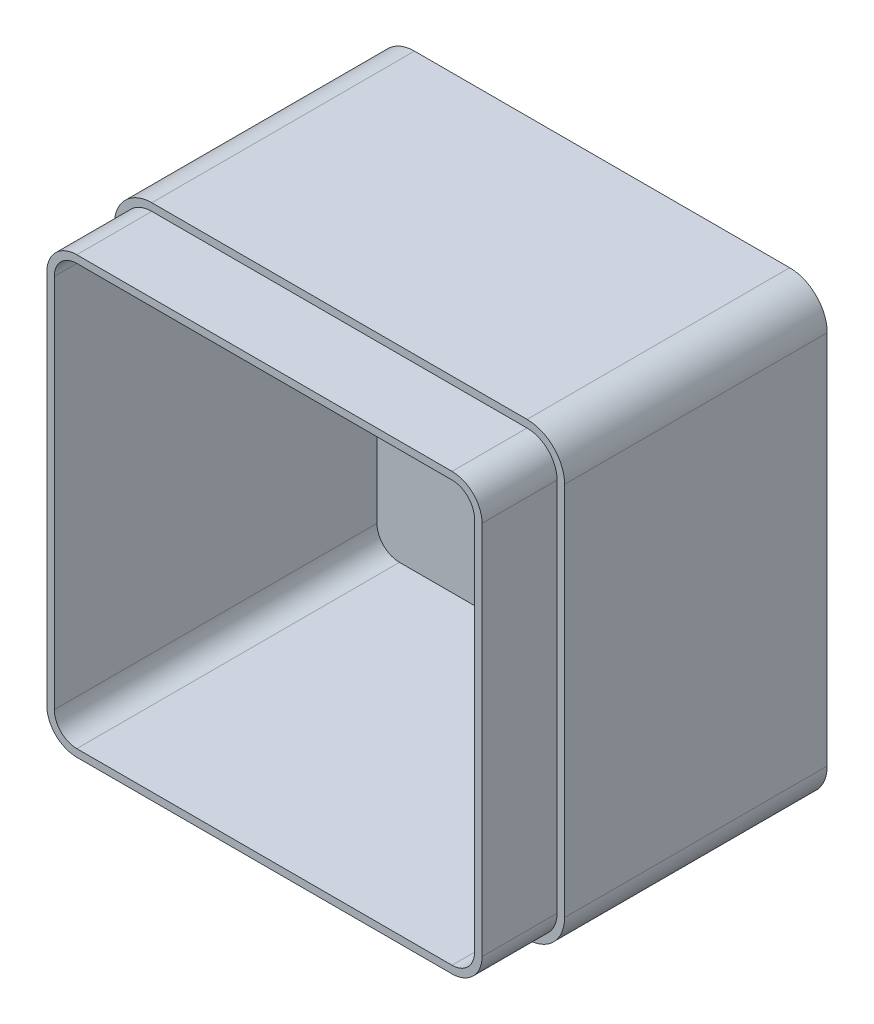
from build123d import *

# Parameters (mm, degrees)
SKETCH1_W           = 120
SKETCH1_H           = 120
BOSS_EXTRUDE1_DEPTH = 90
FILLET1_R           = 10
SHELL1_T            = -4
CUT_EXTRUDE1_DEPTH  = 20


with BuildPart() as part:
    # Sketch1 → Boss-Extrude1 (new body)
    with BuildSketch(Plane.XY):
        with Locations((60, 60)):
            Rectangle(SKETCH1_W, SKETCH1_H)
    extrude(amount=BOSS_EXTRUDE1_DEPTH)

    # Fillet1
    fillet1_edges = [part.edges().sort_by_distance(p)[0] for p in [
        (0, 120, 45),
        (120, 120, 45),
        (120, 0, 45),
        (0, 0, 45),
    ]]
    fillet(fillet1_edges, radius=FILLET1_R)

    # Shell1
    shell1_openings = [part.faces().sort_by_distance(p)[0] for p in [
        (60, 60, 90),
    ]]
    offset(amount=SHELL1_T, openings=shell1_openings, kind=Kind.INTERSECTION)

    # Sketch8 → Cut-Extrude1 (cut)
    with BuildSketch(Plane.XY.offset(90)):
        with BuildLine():
            Line((10, 0), (110, 0))
            ThreePointArc((110, 0), (117.071067812, 2.928932188), (120, 10))
            Line((120, 10), (120, 110))
            ThreePointArc((120, 110), (117.071067812, 117.071067812), (110, 120))
            Line((110, 120), (10, 120))
            ThreePointArc((10, 120), (2.928932188, 117.071067812), (0, 110))
            Line((0, 110), (0, 10))
            ThreePointArc((0, 10), (2.928932188, 2.928932188), (10, 0))
        make_face()
        with BuildLine():
            Line((2, 110), (2, 10))
            ThreePointArc((2, 10), (4.343145751, 4.343145751), (10, 2))
            Line((10, 2), (110, 2))
            ThreePointArc((110, 2), (115.656854249, 4.343145751), (118, 10))
            Line((118, 10), (118, 110))
            ThreePointArc((118, 110), (115.656854249, 115.656854249), (110, 118))
            Line((110, 118), (10, 118))
            ThreePointArc((10, 118), (4.343145751, 115.656854249), (2, 110))
        make_face(mode=Mode.SUBTRACT)
    extrude(amount=-CUT_EXTRUDE1_DEPTH, mode=Mode.SUBTRACT)


solid = part.part
